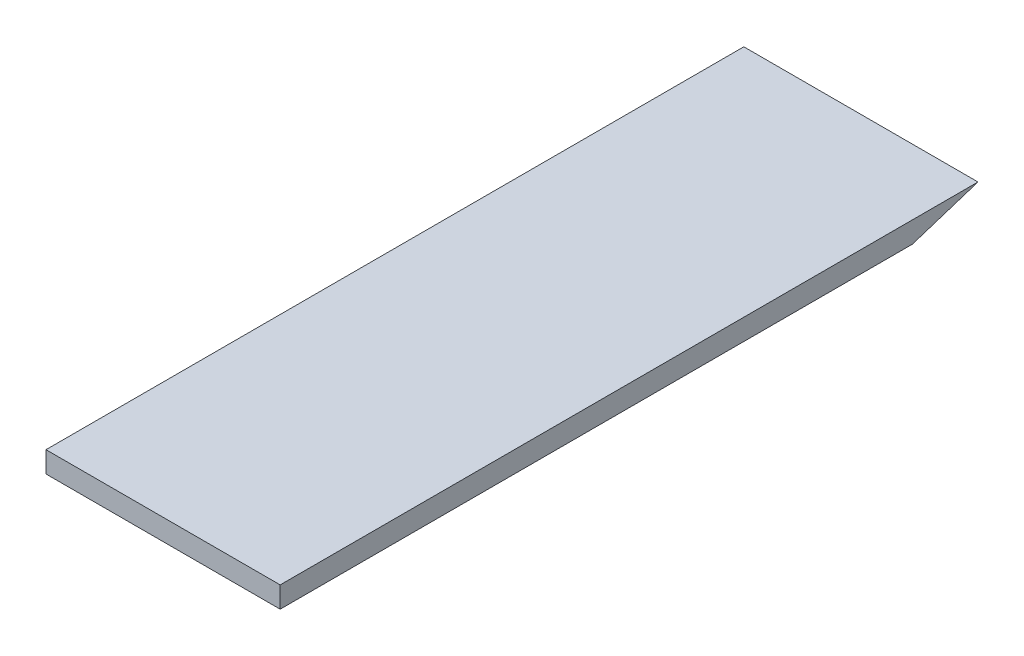
from build123d import *

# Parameters (mm, degrees)
BOSS_EXTRUDE1_DEPTH = 100


with BuildPart() as part:
    # Sketch1 → Boss-Extrude1 (new body)
    with BuildSketch(Plane(origin=(0, 0, 0), x_dir=(0, 0, -1), z_dir=(1, 0, 0))):
        Polygon((0, 9), (0, 0), (270, 0), (298, 9), align=None)
    extrude(amount=BOSS_EXTRUDE1_DEPTH)


solid = part.part
